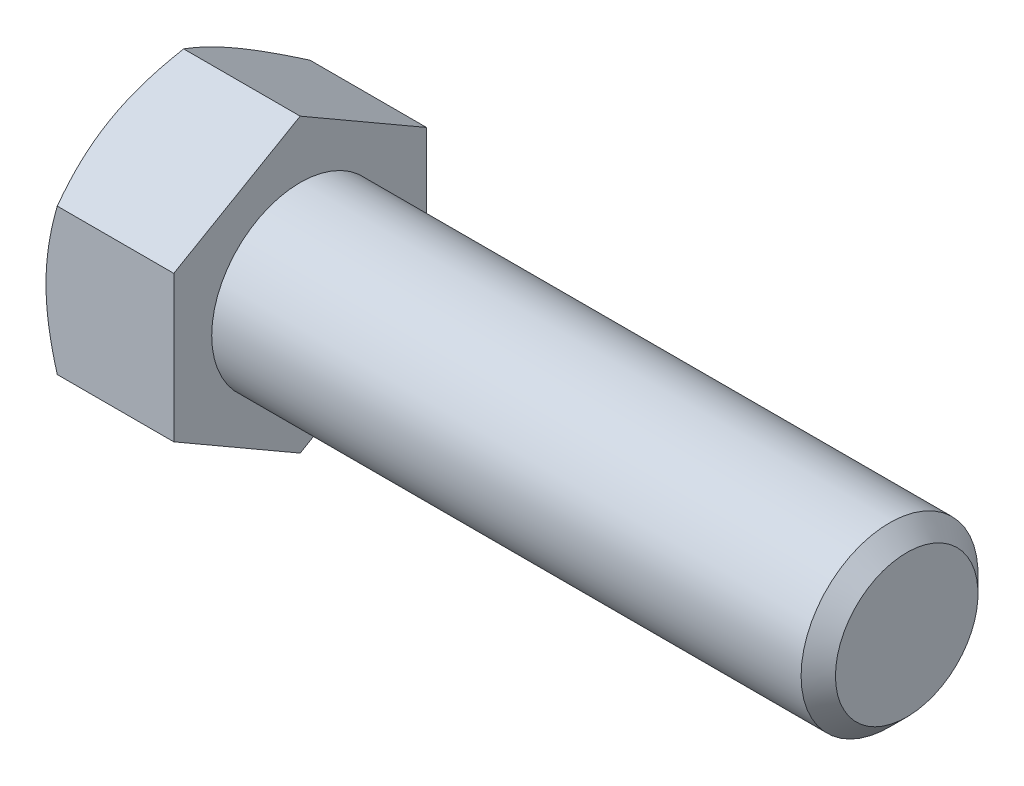
from build123d import *

# Parameters (mm, degrees)
BASEHEAD_DEPTH = 8.0264


with BuildPart() as part:
    # Sketch1 → BaseHead (new body)
    with BuildSketch(Plane(origin=(0, 0, 0), x_dir=(0, 0, -1), z_dir=(1, 0, 0))):
        Polygon((7.9375, 4.582717762), (7.9375, -4.582717762), (0, -9.165435523), (-7.9375, -4.582717762), (-7.9375, 4.582717762), (0, 9.165435523), align=None)
    extrude(amount=BASEHEAD_DEPTH)

    # BodySke → BaseBody (revolve)
    with BuildSketch(Plane.XY, mode=Mode.PRIVATE) as basebody_sk:
        Polygon((0, 0), (46.1264, 0), (46.1264, 4.47675), (45.0469, 5.55625), (0, 5.55625), align=None)
    revolve(basebody_sk.sketch.rotate(Axis((0, 0, 0), (1, 0, 0)), 90), axis=Axis((0, 0, 0), (1, 0, 0)))

    # Sketch3 → HeadChamfer (revolve, cut)
    with BuildSketch(Plane.XY):
        Polygon((0, 7.9375), (4.375123114, 15.515435523), (4.375123114, 21.865435523), (-12.7, 21.865435523), (-12.7, 7.9375), align=None)
    revolve(axis=Axis((0, 0, 0), (1, 0, 0)), mode=Mode.SUBTRACT)


solid = part.part
